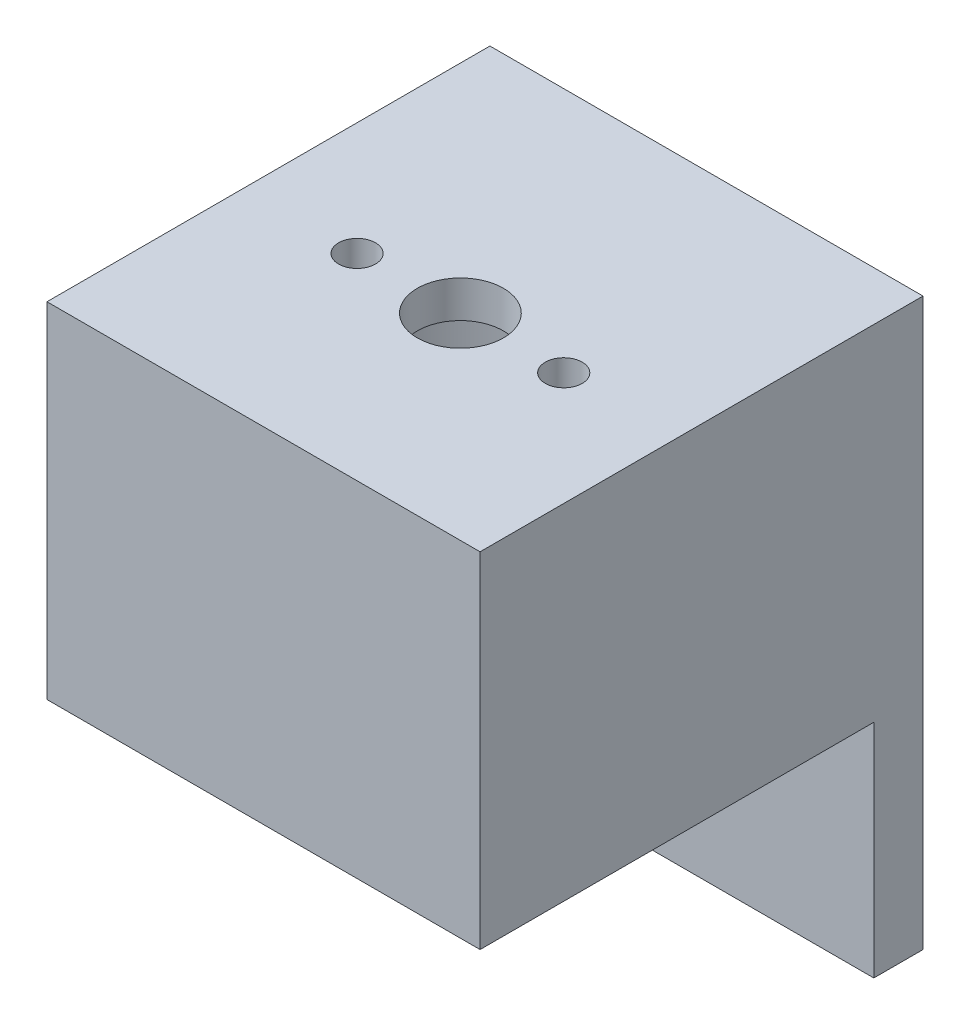
from build123d import *

# Parameters (mm, degrees)
SKETCH_1_W          = 35.2
SKETCH_1_H          = 43
EXTRUDE_1_DEPTH     = 4
SKETCH_2_W          = 35.2
SKETCH_2_H          = 25
EXTRUDE_2_DEPTH     = 32
SKETCH_4_R          = 12.5
CUT_EXTRUDE_1_DEPTH = 32
SKETCH_6_R          = 2
CUT_EXTRUDE_2_DEPTH = 32
SKETCH_7_W          = 35.2
SKETCH_7_H          = 36
EXTRUDE_3_DEPTH     = 3
SKETCH_8_R          = 3.5
SKETCH_8_R_2        = 1.5
CUT_EXTRUDE_3_DEPTH = 10


with BuildPart() as part:
    # Эскиз1 → Бобышка-Вытянуть1 (new body)
    with BuildSketch(Plane.XY):
        Rectangle(SKETCH_1_W, SKETCH_1_H)
    extrude(amount=EXTRUDE_1_DEPTH)

    # Эскиз2 → Бобышка-Вытянуть2 (add)
    with BuildSketch(Plane.XY.offset(4)):
        with Locations((0, 9)):
            Rectangle(SKETCH_2_W, SKETCH_2_H)
    extrude(amount=EXTRUDE_2_DEPTH)

    # Эскиз4 → Вырез-Вытянуть1 (cut)
    with BuildSketch(Plane.XZ.offset(3.5)):
        with Locations(Location((0, 20, 0), (0, 0, 270))):
            Circle(SKETCH_4_R)
    extrude(amount=-CUT_EXTRUDE_1_DEPTH, mode=Mode.SUBTRACT)

    # Эскиз6 → Вырез-Вытянуть2 (cut)
    with BuildSketch(Plane.XY.offset(4)):
        with Locations((0, -7.5)):
            Circle(SKETCH_6_R)
        with Locations((0, -17.5)):
            Circle(SKETCH_6_R)
    extrude(amount=-CUT_EXTRUDE_2_DEPTH, mode=Mode.SUBTRACT)

    # Эскиз7 → Бобышка-Вытянуть3 (add)
    with BuildSketch(Plane(origin=(0, 21.5, 0), x_dir=(1, 0, 0), z_dir=(0, 1, 0))):
        with Locations((0, -18)):
            Rectangle(SKETCH_7_W, SKETCH_7_H)
    extrude(amount=EXTRUDE_3_DEPTH)

    # Эскиз8 → Вырез-Вытянуть3 (cut)
    with BuildSketch(Plane(origin=(0, 24.5, 0), x_dir=(1, 0, 0), z_dir=(0, 1, 0))):
        with Locations(Location((0, -20, 0), (0, 0, 270))):
            Circle(SKETCH_8_R)
        with Locations(Location((8.4, -20, 0), (0, 0, 270))):
            Circle(SKETCH_8_R_2)
        with Locations(Location((-8.4, -20, 0), (0, 0, 270))):
            Circle(SKETCH_8_R_2)
    extrude(amount=-CUT_EXTRUDE_3_DEPTH, mode=Mode.SUBTRACT)


solid = part.part
